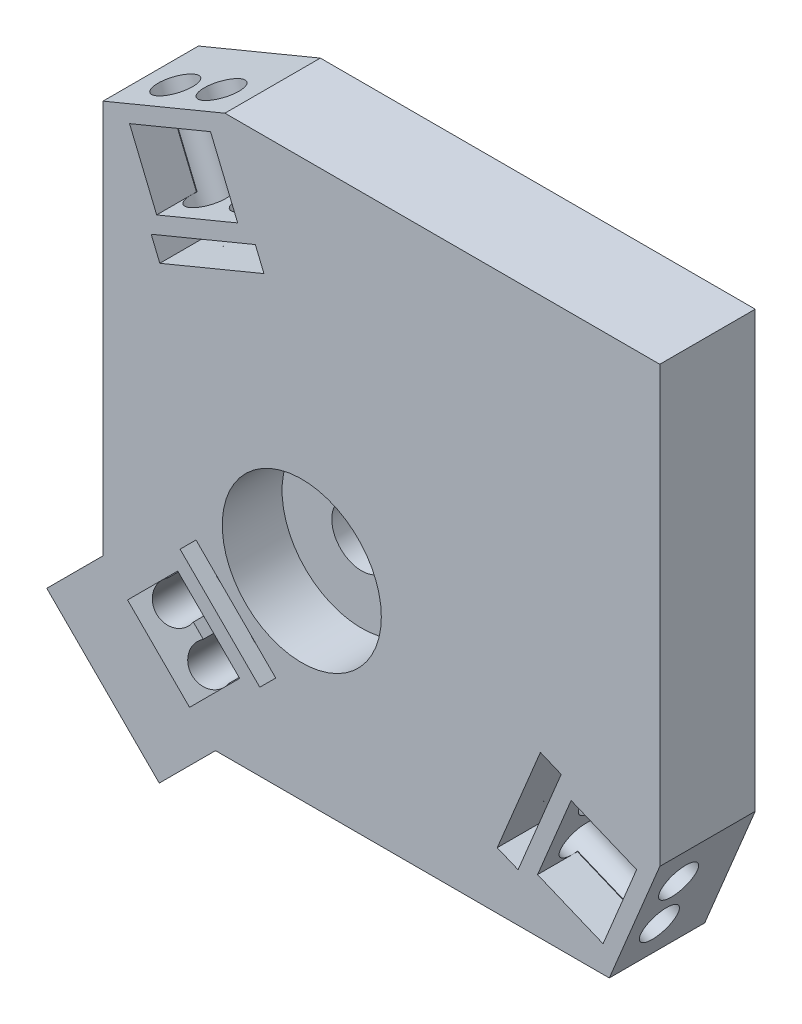
from build123d import *

# Parameters (mm, degrees)
SKETCH1_R                           = 2.38125
BOSS_EXTRUDE1_DEPTH                 = 7.62
MAGNET_START                        = 7.62
SKETCH1_3_R                         = 6.35
MAGNET_HOLE_DEPTH                   = 4.7752
CUT_EXTRUDE2_START                  = 7.62
CUT_EXTRUDE2_DEPTH                  = 5.6
F_3_0MM_DOWEL_HOLE1_D               = 3
F_3_0MM_DOWEL_HOLE1_DEPTH           = 9.106309071
F_3_0MM_DOWEL_HOLE1_TIP             = 0.901290929
F_3_0MM_DOWEL_HOLE1_ON_FACE_2_D     = 3
F_3_0MM_DOWEL_HOLE1_ON_FACE_2_DEPTH = 9.106309071
F_3_0MM_DOWEL_HOLE1_ON_FACE_2_TIP   = 0.901290929
F_3_0MM_DOWEL_HOLE1_ON_FACE_3_D     = 3
F_3_0MM_DOWEL_HOLE1_ON_FACE_3_DEPTH = 9.106309071
F_3_0MM_DOWEL_HOLE1_ON_FACE_3_TIP   = 0.901290929
F_3_0MM_DOWEL_HOLE1_ON_FACE_4_D     = 3
F_3_0MM_DOWEL_HOLE1_ON_FACE_4_DEPTH = 9.106309071
F_3_0MM_DOWEL_HOLE1_ON_FACE_4_TIP   = 0.901290929
F_3_0MM_DOWEL_HOLE1_ON_FACE_5_D     = 3
F_3_0MM_DOWEL_HOLE1_ON_FACE_5_DEPTH = 9.106309071
F_3_0MM_DOWEL_HOLE1_ON_FACE_5_TIP   = 0.901290929
F_3_0MM_DOWEL_HOLE2_D               = 3
F_3_0MM_DOWEL_HOLE2_DEPTH           = 13.2
CUT_EXTRUDE3_START                  = 7.62
CUT_EXTRUDE3_DEPTH                  = 3.175


with BuildPart() as part:
    # Sketch1 → Boss-Extrude1 (new body)
    with BuildSketch(Plane.XY):
        Polygon((44.45, 44.45), (9.731339272, 44.45), (0, 40.419147293), (0, 8.980256121), (-4.490128061, 4.490128061), (4.490128061, -4.490128061), (8.980256121, 0), (40.419147293, 0), (44.45, 9.731339272), align=None)
        with Locations(Location((15.869346859, 15.869346859, 0), (0, 0, 180))):
            Circle(SKETCH1_R, mode=Mode.SUBTRACT)
    extrude(amount=BOSS_EXTRUDE1_DEPTH)

    # Sketch1<3> → Magnet Hole (cut)
    with BuildSketch(Plane.XY.offset(MAGNET_START)):
        with Locations((15.869346859, 15.869346859)):
            Circle(SKETCH1_3_R)
    extrude(amount=-MAGNET_HOLE_DEPTH, mode=Mode.SUBTRACT)

    # Sketch1<4> → Cut-Extrude2 (cut)
    with BuildSketch(Plane.XY.offset(CUT_EXTRUDE2_START)):
        Polygon((36.580836926, 12.161131678), (34.917853767, 12.849961856), (31.473702876, 4.535046063), (33.136686034, 3.846215885), align=None)
        Polygon((6.151828996, 12.515790027), (12.515790027, 6.151828996), (13.788582233, 7.424621202), (7.424621202, 13.788582233), align=None)
        Polygon((12.161131678, 36.580836926), (12.849961856, 34.917853767), (4.535046063, 31.473702876), (3.846215885, 33.136686034), align=None)
    extrude(amount=-CUT_EXTRUDE2_DEPTH, mode=Mode.SUBTRACT)

    # Ø3.0mm Dowel Hole1
    with Locations(Plane(origin=(-1.414213562, 1.414213562, 4.87), x_dir=(-0.707106781187, 0.707106781187, 0), z_dir=(-0.707106781187, -0.707106781187, 0))):
        with Locations((1e-09, 0), (-3.999999999, 0)):
            Hole(F_3_0MM_DOWEL_HOLE1_D / 2, depth=F_3_0MM_DOWEL_HOLE1_DEPTH)
            with Locations((0, 0, -(F_3_0MM_DOWEL_HOLE1_DEPTH + F_3_0MM_DOWEL_HOLE1_TIP / 2))):  # 118° drill point
                Cone(0, F_3_0MM_DOWEL_HOLE1_D / 2, F_3_0MM_DOWEL_HOLE1_TIP, mode=Mode.SUBTRACT)

    # Ø3.0mm Dowel Hole1 on face 2
    with Locations(Plane(origin=(43.199940511, 6.713428701, 4.87), x_dir=(0.382682898036, 0.923879753837, 0), z_dir=(0.923879753837, -0.382682898036, 0))):
        with Locations((0, 0)):
            Hole(F_3_0MM_DOWEL_HOLE1_ON_FACE_2_D / 2, depth=F_3_0MM_DOWEL_HOLE1_ON_FACE_2_DEPTH)
            with Locations((0, 0, -(F_3_0MM_DOWEL_HOLE1_ON_FACE_2_DEPTH + F_3_0MM_DOWEL_HOLE1_ON_FACE_2_TIP / 2))):  # 118° drill point
                Cone(0, F_3_0MM_DOWEL_HOLE1_ON_FACE_2_D / 2, F_3_0MM_DOWEL_HOLE1_ON_FACE_2_TIP, mode=Mode.SUBTRACT)

    # Ø3.0mm Dowel Hole1 on face 3
    with Locations(Plane(origin=(41.669206782, 3.017910571, 4.87), x_dir=(0.382682898036, 0.923879753837, 0), z_dir=(0.923879753837, -0.382682898036, 0))):
        with Locations((0, 0)):
            Hole(F_3_0MM_DOWEL_HOLE1_ON_FACE_3_D / 2, depth=F_3_0MM_DOWEL_HOLE1_ON_FACE_3_DEPTH)
            with Locations((0, 0, -(F_3_0MM_DOWEL_HOLE1_ON_FACE_3_DEPTH + F_3_0MM_DOWEL_HOLE1_ON_FACE_3_TIP / 2))):  # 118° drill point
                Cone(0, F_3_0MM_DOWEL_HOLE1_ON_FACE_3_D / 2, F_3_0MM_DOWEL_HOLE1_ON_FACE_3_TIP, mode=Mode.SUBTRACT)

    # Ø3.0mm Dowel Hole1 on face 4
    with Locations(Plane(origin=(3.017910571, 41.669206782, 4.87), x_dir=(0.923879753837, 0.382682898036, 0), z_dir=(-0.382682898036, 0.923879753837, 0))):
        with Locations((0, 0)):
            Hole(F_3_0MM_DOWEL_HOLE1_ON_FACE_4_D / 2, depth=F_3_0MM_DOWEL_HOLE1_ON_FACE_4_DEPTH)
            with Locations((0, 0, -(F_3_0MM_DOWEL_HOLE1_ON_FACE_4_DEPTH + F_3_0MM_DOWEL_HOLE1_ON_FACE_4_TIP / 2))):  # 118° drill point
                Cone(0, F_3_0MM_DOWEL_HOLE1_ON_FACE_4_D / 2, F_3_0MM_DOWEL_HOLE1_ON_FACE_4_TIP, mode=Mode.SUBTRACT)

    # Ø3.0mm Dowel Hole1 on face 5
    with Locations(Plane(origin=(6.713428701, 43.199940511, 4.87), x_dir=(0.923879753837, 0.382682898036, 0), z_dir=(-0.382682898036, 0.923879753837, 0))):
        with Locations((0, 0)):
            Hole(F_3_0MM_DOWEL_HOLE1_ON_FACE_5_D / 2, depth=F_3_0MM_DOWEL_HOLE1_ON_FACE_5_DEPTH)
            with Locations((0, 0, -(F_3_0MM_DOWEL_HOLE1_ON_FACE_5_DEPTH + F_3_0MM_DOWEL_HOLE1_ON_FACE_5_TIP / 2))):  # 118° drill point
                Cone(0, F_3_0MM_DOWEL_HOLE1_ON_FACE_5_D / 2, F_3_0MM_DOWEL_HOLE1_ON_FACE_5_TIP, mode=Mode.SUBTRACT)

    # Ø3.0mm Dowel Hole2
    with Locations(Plane(origin=(0, 0, 0), x_dir=(-0.7071067811865495, 0.7071067811865457, 0), z_dir=(-0.7071067811865457, -0.7071067811865495, 0))):
        with Locations((-2, -4.87), (2, -4.87)):
            Hole(F_3_0MM_DOWEL_HOLE2_D / 2, depth=F_3_0MM_DOWEL_HOLE2_DEPTH)

    # Sketch1<5> → Cut-Extrude3 (cut)
    with BuildSketch(Plane.XY.offset(CUT_EXTRUDE3_START)):
        Polygon((5.960910165, 10.910657634), (1.958685784, 6.908433252), (6.908433252, 1.958685784), (10.910657634, 5.960910165), align=None)
        Polygon((2.118099231, 39.921854627), (4.284087459, 34.692696473), (10.751244186, 37.3714805), (8.585255959, 42.600638654), align=None)
        Polygon((37.3714805, 10.751244186), (42.600638654, 8.585255959), (39.921854627, 2.118099231), (34.692696473, 4.284087459), align=None)
    extrude(amount=-CUT_EXTRUDE3_DEPTH, mode=Mode.SUBTRACT)


solid = part.part
